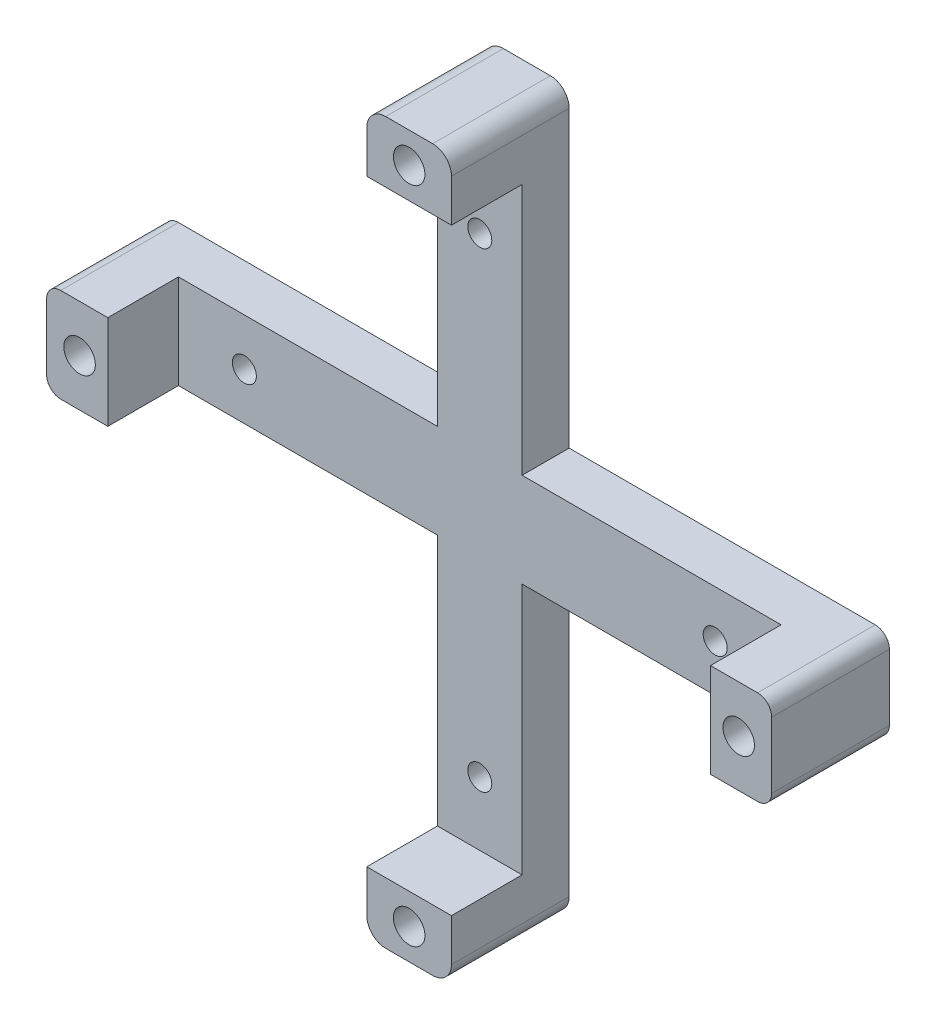
from build123d import *

# Parameters (mm, degrees)
SKETCH1_R           = 4.25
BOSS_EXTRUDE1_DEPTH = 12.7
SKETCH3_R           = 4.25
BOSS_EXTRUDE3_DEPTH = 12.7
SKETCH4_R           = 4.25
BOSS_EXTRUDE4_DEPTH = 19.05
SKETCH5_R           = 3.2385
CUT_EXTRUDE1_DEPTH  = 140.157754455


with BuildPart() as part:
    # Sketch1 → Boss-Extrude1 (new body)
    with BuildSketch(Plane.XY):
        with BuildLine():
            Line((93.98, -12.7), (-93.98, -12.7))
            ThreePointArc((-93.98, -12.7), (-96.674076836, -11.584076836), (-97.79, -8.89))
            Line((-97.79, -8.89), (-97.79, 8.89))
            ThreePointArc((-97.79, 8.89), (-96.674076836, 11.584076836), (-93.98, 12.7))
            Line((-93.98, 12.7), (93.98, 12.7))
            ThreePointArc((93.98, 12.7), (96.674076836, 11.584076836), (97.79, 8.89))
            Line((97.79, 8.89), (97.79, -8.89))
            ThreePointArc((97.79, -8.89), (96.674076836, -11.584076836), (93.98, -12.7))
        make_face()
        with Locations((-88.9, 0)):
            Circle(SKETCH1_R, mode=Mode.SUBTRACT)
        with Locations((88.9, 0)):
            Circle(SKETCH1_R, mode=Mode.SUBTRACT)
    extrude(amount=BOSS_EXTRUDE1_DEPTH)

    # Sketch3 → Boss-Extrude3 (add, through all)
    with BuildSketch(Plane.XY.offset(12.7)):
        with BuildLine():
            Line((-6.335384206, -97.155), (6.335384206, -97.155))
            ThreePointArc((6.335384206, -97.155), (9.927486654, -95.667102448), (11.415384206, -92.075))
            Line((11.415384206, -92.075), (11.415384206, 92.075))
            ThreePointArc((11.415384206, 92.075), (9.927486654, 95.667102448), (6.335384206, 97.155))
            Line((6.335384206, 97.155), (-6.335384206, 97.155))
            ThreePointArc((-6.335384206, 97.155), (-9.927486654, 95.667102448), (-11.415384206, 92.075))
            Line((-11.415384206, 92.075), (-11.415384206, -92.075))
            ThreePointArc((-11.415384206, -92.075), (-9.927486654, -95.667102448), (-6.335384206, -97.155))
        make_face()
        with Locations((0, 88.9)):
            Circle(SKETCH3_R, mode=Mode.SUBTRACT)
        with Locations((0, -88.9)):
            Circle(SKETCH3_R, mode=Mode.SUBTRACT)
    extrude(amount=-BOSS_EXTRUDE3_DEPTH)

    # Sketch4 → Boss-Extrude4 (add)
    # profile 1 of 4: a face of its own
    with BuildSketch(Plane.XY.offset(12.7)):
        with BuildLine():
            Line((-81.28, 12.7), (-93.98, 12.7))
            ThreePointArc((-93.98, 12.7), (-96.674076836, 11.584076836), (-97.79, 8.89))
            Line((-97.79, 8.89), (-97.79, -8.89))
            ThreePointArc((-97.79, -8.89), (-96.674076836, -11.584076836), (-93.98, -12.7))
            Line((-93.98, -12.7), (-81.28, -12.7))
            Line((-81.28, -12.7), (-81.28, 12.7))
        make_face()
        with Locations((-88.9, 0)):
            Circle(SKETCH4_R, mode=Mode.SUBTRACT)
    # profile 2 of 4: a face of its own
    with BuildSketch(Plane.XY.offset(12.7)):
        with BuildLine():
            Line((-11.415384206, 92.075), (-11.415384206, 80.645))
            Line((-11.415384206, 80.645), (11.415384206, 80.645))
            Line((11.415384206, 80.645), (11.415384206, 92.075))
            ThreePointArc((11.415384206, 92.075), (9.927486654, 95.667102448), (6.335384206, 97.155))
            Line((6.335384206, 97.155), (-6.335384206, 97.155))
            ThreePointArc((-6.335384206, 97.155), (-9.927486654, 95.667102448), (-11.415384206, 92.075))
        make_face()
        with Locations((0, 88.9)):
            Circle(SKETCH4_R, mode=Mode.SUBTRACT)
    # profile 3 of 4: a face of its own
    with BuildSketch(Plane.XY.offset(12.7)):
        with BuildLine():
            Line((93.98, 12.7), (81.28, 12.7))
            Line((81.28, 12.7), (81.28, -12.7))
            Line((81.28, -12.7), (93.98, -12.7))
            ThreePointArc((93.98, -12.7), (96.674076836, -11.584076836), (97.79, -8.89))
            Line((97.79, -8.89), (97.79, 8.89))
            ThreePointArc((97.79, 8.89), (96.674076836, 11.584076836), (93.98, 12.7))
        make_face()
        with Locations((88.9, 0)):
            Circle(SKETCH4_R, mode=Mode.SUBTRACT)
    # profile 4 of 4: a face of its own
    with BuildSketch(Plane.XY.offset(12.7)):
        with BuildLine():
            Line((11.415384206, -80.645), (-11.415384206, -80.645))
            Line((-11.415384206, -80.645), (-11.415384206, -92.075))
            ThreePointArc((-11.415384206, -92.075), (-9.927486654, -95.667102448), (-6.335384206, -97.155))
            Line((-6.335384206, -97.155), (6.335384206, -97.155))
            ThreePointArc((6.335384206, -97.155), (9.927486654, -95.667102448), (11.415384206, -92.075))
            Line((11.415384206, -92.075), (11.415384206, -80.645))
        make_face()
        with Locations((0, -88.9)):
            Circle(SKETCH4_R, mode=Mode.SUBTRACT)
    extrude(amount=BOSS_EXTRUDE4_DEPTH)

    # Sketch5 → Cut-Extrude1 (cut, through all)
    with BuildSketch(Plane.XY.offset(12.7)):
        with Locations((0, 63.5)):
            Circle(SKETCH5_R)
        with Locations((63.5, 0)):
            Circle(SKETCH5_R)
        with Locations((0, -63.5)):
            Circle(SKETCH5_R)
        with Locations((-63.5, 0)):
            Circle(SKETCH5_R)
    extrude(amount=-CUT_EXTRUDE1_DEPTH, mode=Mode.SUBTRACT)


solid = part.part
